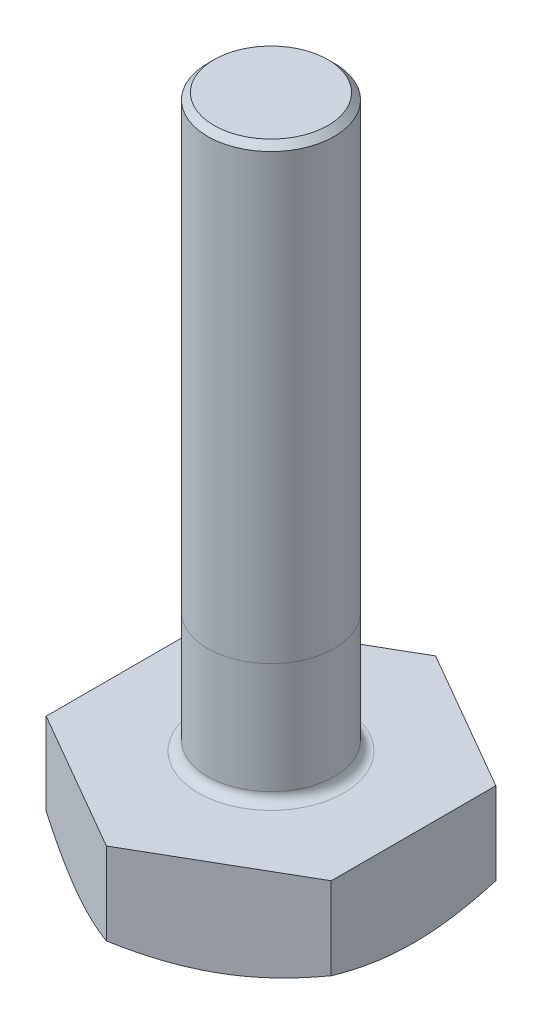
from build123d import *

# Parameters (mm, degrees)
SALIENTE_EXTRUIR1_DEPTH = 1.5
CROQUIS3_OUTSIDE_W      = 13.104
CROQUIS3_OUTSIDE_H      = 13.8
CROQUIS3_OUTSIDE_R      = 2.25
CORTAR_EXTRUIR6_DEPTH   = 1.5
CORTAR_EXTRUIR6_DRAFT   = 60
CROQUIS4_R              = 1
SALIENTE_EXTRUIR2_DEPTH = 9
CHAFL_N1_SIZE           = 0.1
REDONDEO1_R             = 0.15


with BuildPart() as part:
    # Croquis2 → Saliente-Extruir1 (new body)
    with BuildSketch(Plane(origin=(0, 0, 0), x_dir=(1, 0, 0), z_dir=(0, 1, 0))):
        Polygon((0, -2.598076211), (2.25, -1.299038106), (2.25, 1.299038106), (0, 2.598076211), (-2.25, 1.299038106), (-2.25, -1.299038106), align=None)
    extrude(amount=SALIENTE_EXTRUIR1_DEPTH)


with BuildPart() as cortar_extruir6_tool:
    # Croquis3 outside → Cortar-Extruir6 (with draft: the straight prism first)
    with BuildSketch(Plane(origin=(0, 0, 0), x_dir=(1, 0, 0), z_dir=(0, 1, 0))):
        Rectangle(CROQUIS3_OUTSIDE_W, CROQUIS3_OUTSIDE_H)
        Circle(CROQUIS3_OUTSIDE_R, mode=Mode.SUBTRACT)
    extrude(amount=CORTAR_EXTRUIR6_DEPTH)
    # Cortar-Extruir6: the draft: its side faces are tilted about the plane it starts from
    cortar_extruir6_sides = [cortar_extruir6_tool.faces().sort_by_distance(p)[0] for p in [
        (0, 0.75, 6.9),
        (6.552, 0.75, 0),
        (0, 0.75, -6.9),
        (-6.552, 0.75, 0),
        (-2.25, 0.75, 0),
    ]]
    draft(cortar_extruir6_sides, Plane(origin=(0, 0, 0), x_dir=(1, 0, 0), z_dir=(0, 1, 0)), CORTAR_EXTRUIR6_DRAFT)


with BuildPart() as part_1:
    add(part.part)

    # Cortar-Extruir6: cut by cortar_extruir6_tool
    add(cortar_extruir6_tool.part, mode=Mode.SUBTRACT)

    # Croquis4 → Saliente-Extruir2 (add)
    with BuildSketch(Plane(origin=(0, 1.5, 0), x_dir=(1, 0, 0), z_dir=(0, 1, 0))):
        with Locations(Location((0, 0, 0), (0, 0, 270))):
            Circle(CROQUIS4_R)
    extrude(amount=SALIENTE_EXTRUIR2_DEPTH)

    # Chaflán1
    chafl_n1_edges = [part_1.edges().sort_by_distance(p)[0] for p in [
        (0, 10.5, -1),
    ]]
    chamfer(chafl_n1_edges, length=CHAFL_N1_SIZE)

    # Redondeo1
    redondeo1_edges = [part_1.edges().sort_by_distance(p)[0] for p in [
        (0, 1.5, -1),
    ]]
    fillet(redondeo1_edges, radius=REDONDEO1_R)


solid = part_1.part
